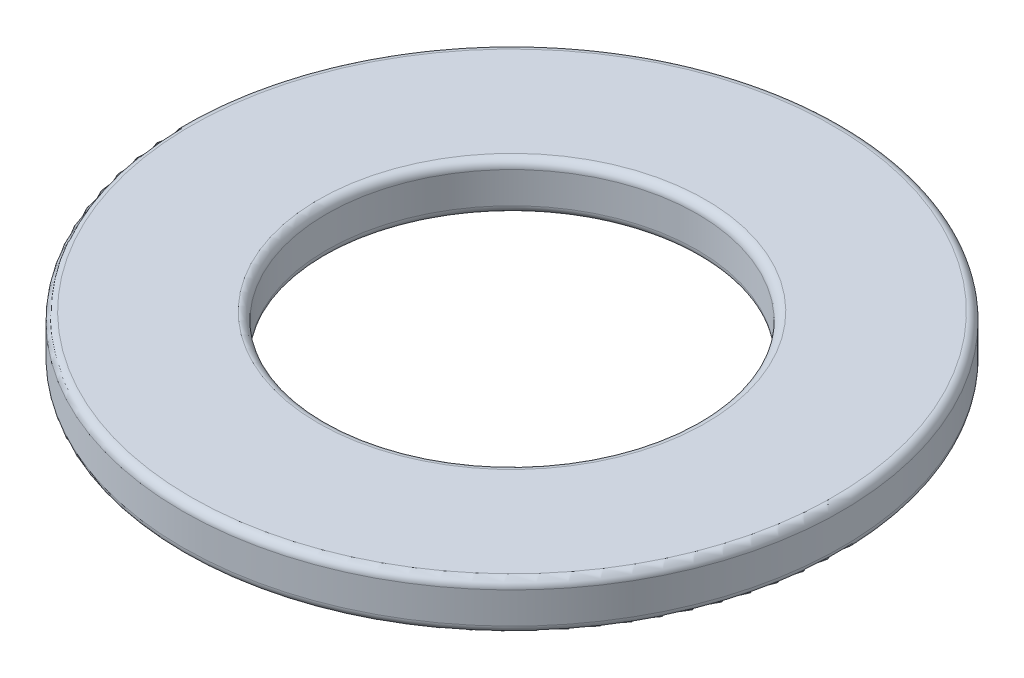
from build123d import *

# Parameters (mm, degrees)
SKETCH2_R           = 200
SKETCH2_R_2         = 112.5
BOSS_EXTRUDE1_DEPTH = 29
FILLET1_R           = 5


with BuildPart() as part:
    # Sketch2 → Boss-Extrude1 (new body)
    with BuildSketch(Plane(origin=(0, 0, 0), x_dir=(1, 0, 0), z_dir=(0, 1, 0))):
        with Locations(Location((0, 0, 0), (0, 0, 270))):
            Circle(SKETCH2_R)
        with Locations(Location((0, 0, 0), (0, 0, 270))):
            Circle(SKETCH2_R_2, mode=Mode.SUBTRACT)
    extrude(amount=BOSS_EXTRUDE1_DEPTH)

    # Fillet1
    fillet1_edges = [part.edges().sort_by_distance(p)[0] for p in [
        (0, 0, -200),
        (0, 29, -200),
        (0, 0, -112.5),
        (0, 29, -112.5),
    ]]
    fillet(fillet1_edges, radius=FILLET1_R)


solid = part.part
